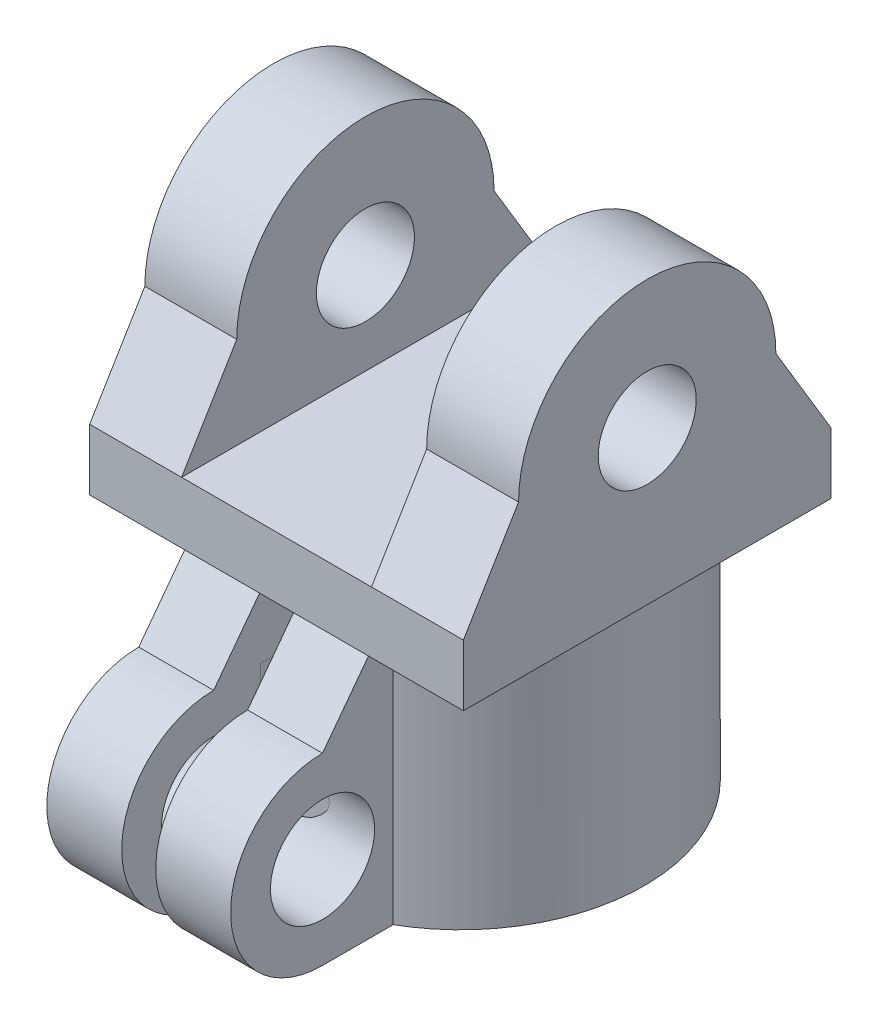
from build123d import *

# Parameters (mm, degrees)
SKETCH_1_R           = 6
SKETCH_1_R_2         = 4.2
EXTRUDE_1_DEPTH      = 8
SKETCH_2_W           = 12.2
SKETCH_2_H           = 12
EXTRUDE_2_DEPTH      = 2
SKETCH_3_R           = 1.6
EXTRUDE_3_DEPTH      = 3
EXTRUDE_4_DEPTH      = 3
EXTRUDE_4_DEPTH_BACK = 3
SKETCH_4_R           = 1.7
SKETCH_5_R           = 4.2
CUT_EXTRUDE_1_DEPTH  = 6
SKETCH_6_W           = 1.109396916
SKETCH_6_H           = 8
CUT_EXTRUDE_2_DEPTH  = 22.054690689


with BuildPart() as part:
    # 草图1 → 凸台-拉伸1 (new body)
    with BuildSketch(Plane(origin=(0, 0, 0), x_dir=(1, 0, 0), z_dir=(0, 1, 0))):
        with Locations(Location((0, 0, 0), (0, 0, 270))):
            Circle(SKETCH_1_R)
        with Locations(Location((0, 0, 0), (0, 0, 270))):
            Circle(SKETCH_1_R_2, mode=Mode.SUBTRACT)
    extrude(amount=EXTRUDE_1_DEPTH)

    # 草图2 → 凸台-拉伸2 (add)
    with BuildSketch(Plane(origin=(0, 8, 0), x_dir=(1, 0, 0), z_dir=(0, 1, 0))):
        Rectangle(SKETCH_2_W, SKETCH_2_H)
    extrude_2 = extrude(amount=EXTRUDE_2_DEPTH)

    # 草图3 → 凸台-拉伸3 (add)
    with BuildSketch(Plane.ZY.offset(6.1)):
        with BuildLine():
            Line((-6, 10), (6, 10))
            Line((6, 10), (4.2, 13))
            ThreePointArc((4.2, 13), (0, 17.2), (-4.2, 13))
            Line((-4.2, 13), (-6, 10))
        make_face()
        with Locations((0, 13)):
            Circle(SKETCH_3_R, mode=Mode.SUBTRACT)
    extrude_3 = extrude(amount=-EXTRUDE_3_DEPTH)

    # 镜向1: 凸台-拉伸2, 凸台-拉伸3 across plane
    add(extrude_2.mirror(Plane(origin=(0, 0, 0), x_dir=(0, 0, 1), z_dir=(1, 0, 0))))
    add(extrude_3.mirror(Plane(origin=(0, 0, 0), x_dir=(0, 0, 1), z_dir=(1, 0, 0))))


with BuildPart() as body_2:
    # 草图4 → 凸台-拉伸4 (new, two sides: drawn at the far end of the back side and taken through both)
    with BuildSketch(Plane(origin=(0, 0, 0), x_dir=(0, 0, -1), z_dir=(1, 0, 0)).offset(-EXTRUDE_4_DEPTH_BACK)):
        with BuildLine():
            Line((-6, 8), (0, 8))
            Line((0, 8), (0, 0))
            Line((0, 0), (-7.5, 0))
            ThreePointArc((-7.5, 0), (-10.5, 3), (-7.5, 6))
            Line((-7.5, 6), (-6, 8))
        make_face()
        with Locations((-7.5, 3)):
            Circle(SKETCH_4_R, mode=Mode.SUBTRACT)
    extrude(amount=EXTRUDE_4_DEPTH + EXTRUDE_4_DEPTH_BACK)

    # 草图5 → 切除-拉伸1 (cut)
    with BuildSketch(Plane.XZ):
        with Locations(Location((0, 0, 0), (0, 0, 90))):
            Circle(SKETCH_5_R)
    extrude(amount=-CUT_EXTRUDE_1_DEPTH, mode=Mode.SUBTRACT)


with BuildPart() as cut_extrude_2_tool:
    # 草图6 → 切除-拉伸2 (new, through all)
    with BuildSketch(Plane.XY):
        with Locations((0, 4)):
            Rectangle(SKETCH_6_W, SKETCH_6_H)
    extrude(amount=CUT_EXTRUDE_2_DEPTH)


with BuildPart() as part_1:
    add(part.part)

    # 切除-拉伸2: cut by cut_extrude_2_tool
    add(cut_extrude_2_tool.part, mode=Mode.SUBTRACT)


with BuildPart() as body_2_1:
    add(body_2.part)

    # 切除-拉伸2: cut by cut_extrude_2_tool
    add(cut_extrude_2_tool.part, mode=Mode.SUBTRACT)


solid = Compound([part_1.part, body_2_1.part])
